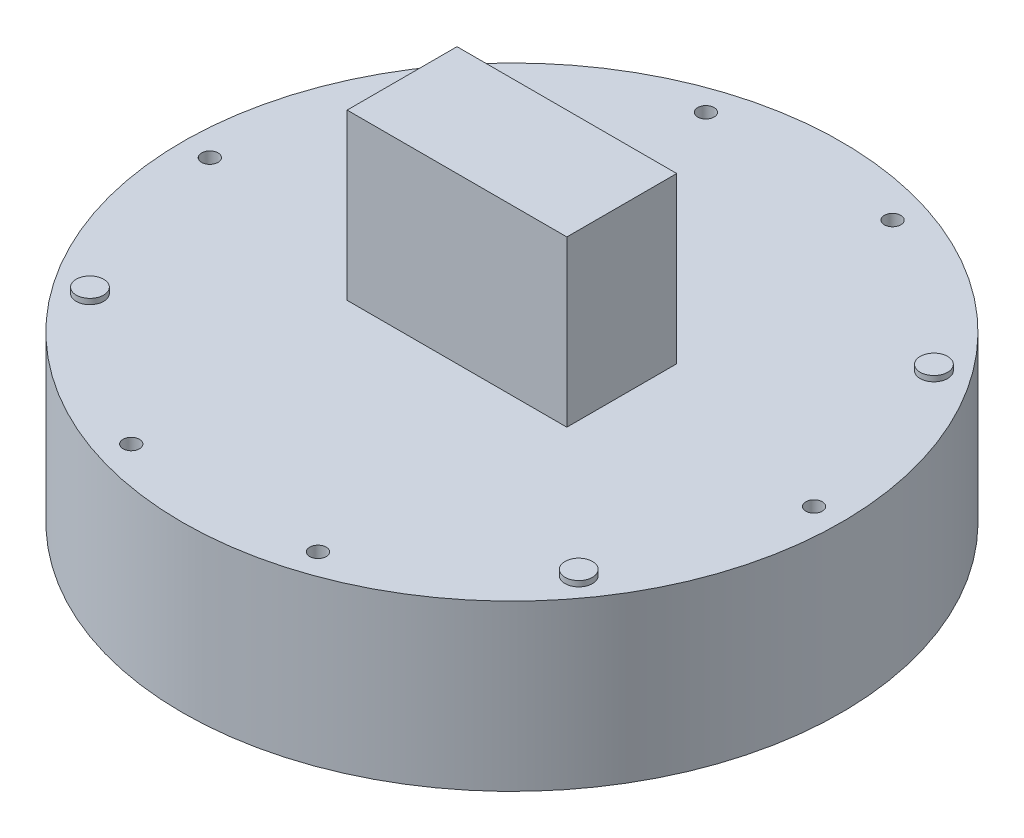
from build123d import *

# Parameters (mm, degrees)
SKETCH_1_R               = 60
EXTRUDE_1_DEPTH          = 30
SKETCH_2_R               = 1.5
CUT_EXTRUDE_1_DEPTH      = 5
PATTERN_CIRCULAR_1_COUNT = 10
SKETCH_3_W               = 40
SKETCH_3_H               = 20
EXTRUDE_2_DEPTH          = 30
SKETCH_5_R               = 2.5
EXTRUDE_4_DEPTH          = 1


with BuildPart() as part:
    # 草图1 → 凸台-拉伸1 (new body)
    with BuildSketch(Plane(origin=(0, 0, 0), x_dir=(1, 0, 0), z_dir=(0, 1, 0))):
        with Locations(Location((0, 0, 0), (0, 0, 270))):
            Circle(SKETCH_1_R)
    extrude(amount=EXTRUDE_1_DEPTH)

    # 草图2 → 切除-拉伸1 (cut)
    with BuildSketch(Plane(origin=(0, 30, 0), x_dir=(1, 0, 0), z_dir=(0, 1, 0))):
        with Locations(Location((55, 0, 0), (0, 0, 270))):
            Circle(SKETCH_2_R)
    cut_extrude_1 = extrude(amount=-CUT_EXTRUDE_1_DEPTH, mode=Mode.SUBTRACT)

    # 阵列(圆周)1: 切除-拉伸1 ×10 about axis
    pattern_circular_1_axis = Axis((0, 0, 0), (0, 1, 0))
    for i in range(1, PATTERN_CIRCULAR_1_COUNT):
        add(cut_extrude_1.rotate(pattern_circular_1_axis, i * 360 / PATTERN_CIRCULAR_1_COUNT), mode=Mode.SUBTRACT)

    # 草图3 → 凸台-拉伸2 (add)
    with BuildSketch(Plane(origin=(0, 30, 0), x_dir=(1, 0, 0), z_dir=(0, 1, 0))):
        Rectangle(SKETCH_3_W, SKETCH_3_H)
    extrude(amount=EXTRUDE_2_DEPTH)

    # 草图5 → 凸台-拉伸4 (add)
    with BuildSketch(Plane(origin=(0, 30, 0), x_dir=(1, 0, 0), z_dir=(0, 1, 0))):
        with Locations(Location((-44.495934691, 32.328188876, 0), (0, 0, 270))):
            Circle(SKETCH_5_R)
        with Locations(Location((44.495934691, -32.328188876, 0), (0, 0, 270))):
            Circle(SKETCH_5_R)
        with Locations(Location((44.495934691, 32.328188876, 0), (0, 0, 270))):
            Circle(SKETCH_5_R)
        with Locations(Location((-44.495934691, -32.328188876, 0), (0, 0, 270))):
            Circle(SKETCH_5_R)
    extrude(amount=EXTRUDE_4_DEPTH)


solid = part.part
